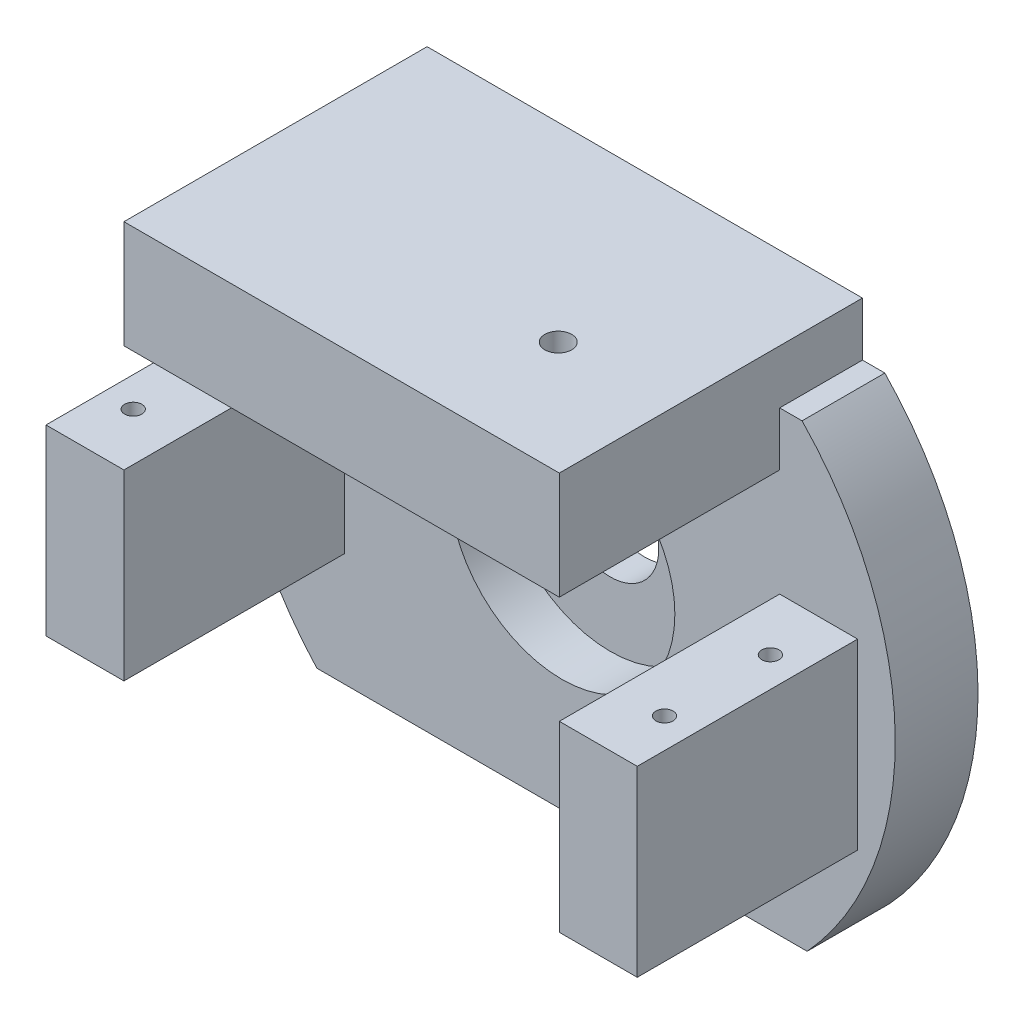
from build123d import *

# Parameters (mm, degrees)
ESQUISSE1_W              = 55
ESQUISSE1_H              = 43
BOSS_EXTRU_1_DEPTH       = 27
ESQUISSE2_W              = 40.5
ESQUISSE2_H              = 21.676575317
ENL_V_MAT_EXTRU_1_DEPTH  = 38
ESQUISSE3_R              = 0.7
ENL_V_MAT_EXTRU_2_DEPTH  = 43
ESQUISSE4_W              = 55
ESQUISSE4_H              = 20.5
ENL_V_MAT_EXTRU_3_DEPTH  = 11
ENL_V_MAT_EXTRU_6_REACH  = 66.933
ESQUISSE5_W              = 20.5
ESQUISSE5_H              = 10
ESQUISSE6_W              = 7.25
ESQUISSE6_H              = 20.5
ENL_V_MAT_EXTRU_7_DEPTH  = 5
ESQUISSE7_R              = 31
BOSS_EXTRU_2_DEPTH       = 6.5
ESQUISSE8_R              = 41
ESQUISSE8_R_2            = 31
ENL_V_MAT_EXTRU_8_DEPTH  = 6.5
TROU_TARAUD_M2X0_41_D    = 1.6
ESQUISSE10_R             = 10.5
ENL_V_MAT_EXTRU_9_DEPTH  = 4.5
ESQUISSE11_R             = 4.5
ENL_V_MAT_EXTRU_10_DEPTH = 2
ESQUISSE12_R             = 9.25
ESQUISSE12_R_2           = 1.25
BOSS_EXTRU_3_DEPTH       = 5
ESQUISSE13_W             = 50.114904395
ESQUISSE13_H             = 12.012600019
ENL_V_MAT_EXTRU_11_DEPTH = 6.5
BOSS_EXTRU_4_START       = 1.2
BOSS_EXTRU_4_DEPTH       = 1.2
ESQUISSE15_W             = 53.005482756
ESQUISSE15_H             = 10
ENL_V_MAT_EXTRU_12_DEPTH = 7.7
ESQUISSE16_R             = 4.5
ENL_V_MAT_EXTRU_13_DEPTH = 1.2
BOSS_EXTRU_5_START       = -28.2
ESQUISSE17_W             = 40.5
ESQUISSE17_H             = 5
BOSS_EXTRU_5_DEPTH       = 28.2
ESQUISSE18_R             = 1
ENL_V_MAT_EXTRU_14_DEPTH = 10
TROU_TARAUD_M3X0_51_D    = 2.5


with BuildPart() as part:
    # Esquisse1 → Boss.-Extru.1 (new body)
    with BuildSketch(Plane.XY):
        Rectangle(ESQUISSE1_W, ESQUISSE1_H)
    extrude(amount=BOSS_EXTRU_1_DEPTH)

    # Esquisse2 → Enlèv. mat.-Extru.1 (cut)
    with BuildSketch(Plane.XZ.offset(21.5)):
        with Locations((0, 17.338287659)):
            Rectangle(ESQUISSE2_W, ESQUISSE2_H)
    extrude(amount=-ENL_V_MAT_EXTRU_1_DEPTH, mode=Mode.SUBTRACT)

    # Esquisse3 → Enlèv. mat.-Extru.2 (cut)
    with BuildSketch(Plane.XZ.offset(21.5)):
        with Locations(Location((-24.71, 21.675, 0), (0, 0, 270))):
            Circle(ESQUISSE3_R)
        with Locations(Location((-24.71, 11.825, 0), (0, 0, 270))):
            Circle(ESQUISSE3_R)
        with Locations(Location((24.71, 11.825, 0), (0, 0, 270))):
            Circle(ESQUISSE3_R)
        with Locations(Location((24.71, 21.675, 0), (0, 0, 270))):
            Circle(ESQUISSE3_R)
    extrude(amount=-ENL_V_MAT_EXTRU_2_DEPTH, mode=Mode.SUBTRACT)

    # Esquisse4 → Enlèv. mat.-Extru.3 (cut)
    with BuildSketch(Plane.XZ.offset(21.5)):
        with Locations((0, 16.75)):
            Rectangle(ESQUISSE4_W, ESQUISSE4_H)
    extrude(amount=-ENL_V_MAT_EXTRU_3_DEPTH, mode=Mode.SUBTRACT)

    # Enlèv. mat.-Extru.6: up to this face of the body (flat: up to its plane)
    enl_v_mat_extru_6_end = Plane(part.part.faces().sort_by_distance((27.5, 3.85676109, 12.716595404))[0])
    # Esquisse5 → Enlèv. mat.-Extru.6 (cut, up to the picked face)
    with BuildSketch(Plane.ZY.offset(27.5), mode=Mode.PRIVATE) as enl_v_mat_extru_6_sk1:
        with Locations((16.75, 11.5)):
            Rectangle(ESQUISSE5_W, ESQUISSE5_H)
    enl_v_mat_extru_6_tool1 = split(extrude(enl_v_mat_extru_6_sk1.sketch, amount=-ENL_V_MAT_EXTRU_6_REACH, mode=Mode.PRIVATE), bisect_by=enl_v_mat_extru_6_end, keep=Keep.BOTH, mode=Mode.PRIVATE)
    add(enl_v_mat_extru_6_tool1.solids().sort_by(Axis((-27.5, 11.5, 16.75), (1, 0, 0)))[0], mode=Mode.SUBTRACT)

    # Esquisse6 → Enlèv. mat.-Extru.7 (cut)
    with BuildSketch(Plane.XZ.offset(-16.5)):
        with Locations((-23.875, 16.75)):
            Rectangle(ESQUISSE6_W, ESQUISSE6_H)
        with Locations((23.875, 16.75)):
            Rectangle(ESQUISSE6_W, ESQUISSE6_H)
    extrude(amount=-ENL_V_MAT_EXTRU_7_DEPTH, mode=Mode.SUBTRACT)

    # Esquisse7 → Boss.-Extru.2 (add)
    with BuildSketch(Plane(origin=(0, 0, 0), x_dir=(-1, 0, 0), z_dir=(0, 0, -1))):
        Circle(ESQUISSE7_R)
    extrude(amount=-BOSS_EXTRU_2_DEPTH)

    # Esquisse8 → Enlèv. mat.-Extru.8 (cut)
    with BuildSketch(Plane(origin=(0, 0, 0), x_dir=(-1, 0, 0), z_dir=(0, 0, -1))):
        Circle(ESQUISSE8_R)
        Circle(ESQUISSE8_R_2, mode=Mode.SUBTRACT)
    extrude(amount=-ENL_V_MAT_EXTRU_8_DEPTH, mode=Mode.SUBTRACT)

    # Trou taraudé M2x0.41 (through all)
    with Locations(Plane(origin=(-24.71, -10.5, 21.675), x_dir=(0, 0, -1), z_dir=(0, -1, 0))):
        with Locations((0, 0), (9.85, 0), (0, 49.42), (9.85, 49.42)):
            Hole(TROU_TARAUD_M2X0_41_D / 2)

    # Esquisse10 → Enlèv. mat.-Extru.9 (cut)
    with BuildSketch(Plane.XY.offset(6.5)):
        Circle(ESQUISSE10_R)
    extrude(amount=-ENL_V_MAT_EXTRU_9_DEPTH, mode=Mode.SUBTRACT)

    # Esquisse11 → Enlèv. mat.-Extru.10 (cut)
    with BuildSketch(Plane.XY.offset(2)):
        Circle(ESQUISSE11_R)
    extrude(amount=-ENL_V_MAT_EXTRU_10_DEPTH, mode=Mode.SUBTRACT)

    # Esquisse12 → Boss.-Extru.3 (add)
    with BuildSketch(Plane(origin=(0, 21.5, 0), x_dir=(1, 0, 0), z_dir=(0, 1, 0))):
        with Locations(Location((0, -15.876822983, 0), (0, 0, 90))):
            Circle(ESQUISSE12_R)
        with Locations(Location((0, -15.876822983, 0), (0, 0, 270))):
            Circle(ESQUISSE12_R_2, mode=Mode.SUBTRACT)
    extrude(amount=BOSS_EXTRU_3_DEPTH)

    # Esquisse13 → Enlèv. mat.-Extru.11 (cut)
    with BuildSketch(Plane.XY.offset(6.5)):
        with Locations((-0.983340997, 27.50630001)):
            Rectangle(ESQUISSE13_W, ESQUISSE13_H)
    extrude(amount=-ENL_V_MAT_EXTRU_11_DEPTH, mode=Mode.SUBTRACT)

    # Esquisse14 → Boss.-Extru.4 (add)
    with BuildSketch(Plane(origin=(0, 0, 0), x_dir=(-1, 0, 0), z_dir=(0, 0, -1)).offset(BOSS_EXTRU_4_START)):
        with BuildLine():
            Line((-22.332711434, 21.5), (22.332711434, 21.5))
            ThreePointArc((22.332711434, 21.5), (0, -31), (-22.332711434, 21.5))
        make_face()
    extrude(amount=-BOSS_EXTRU_4_DEPTH)

    # Esquisse15 → Enlèv. mat.-Extru.12 (cut)
    with BuildSketch(Plane.XY.offset(6.5)):
        with Locations((0, -26)):
            Rectangle(ESQUISSE15_W, ESQUISSE15_H)
    extrude(amount=-ENL_V_MAT_EXTRU_12_DEPTH, mode=Mode.SUBTRACT)

    # Esquisse16 → Enlèv. mat.-Extru.13 (cut)
    with BuildSketch(Plane.XY):
        Circle(ESQUISSE16_R)
    extrude(amount=-ENL_V_MAT_EXTRU_13_DEPTH, mode=Mode.SUBTRACT)

    # Esquisse17 → Boss.-Extru.5 (add)
    with BuildSketch(Plane.XY.offset(27).offset(BOSS_EXTRU_5_START)):
        with Locations((0, 24)):
            Rectangle(ESQUISSE17_W, ESQUISSE17_H)
    extrude(amount=BOSS_EXTRU_5_DEPTH)

    # Esquisse18 → Enlèv. mat.-Extru.14 (cut)
    with BuildSketch(Plane(origin=(0, 26.5, 0), x_dir=(1, 0, 0), z_dir=(0, 1, 0))):
        with Locations(Location((9.65, -16.5, 0), (0, 0, 270))):
            Circle(ESQUISSE18_R)
    extrude(amount=-ENL_V_MAT_EXTRU_14_DEPTH, mode=Mode.SUBTRACT)

    # Trou taraudé M3x0.51 (through all)
    with Locations(Plane(origin=(9.65, 26.5, 16.5), x_dir=(0, 0, 1), z_dir=(0, 1, 0))):
        with Locations((0, 0)):
            Hole(TROU_TARAUD_M3X0_51_D / 2)


solid = part.part
